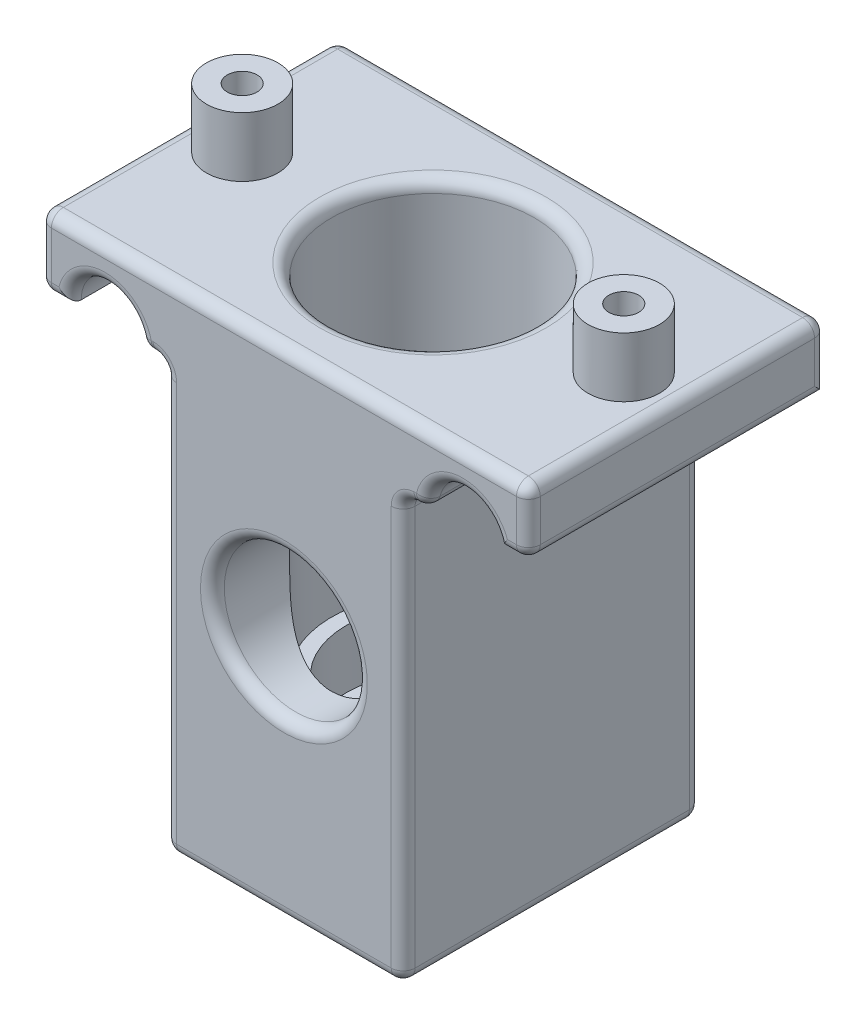
from build123d import *

# Parameters (mm, degrees)
CROQUIS1_R                                           = 6
SALIENTE_EXTRUIR1_DEPTH                              = 12.5
CROQUIS2_R                                           = 8.5
CORTAR_EXTRUIR1_DEPTH                                = 30
REDONDEO2_R                                          = 1
CROQUIS5_R                                           = 3
SALIENTE_EXTRUIR2_DEPTH                              = 5
PERFORADOR_PARA_ROSCAR_PARA_MACHO_DE_ROS_D           = 2.5
PERFORADOR_PARA_ROSCAR_PARA_MACHO_DE_ROS_DEPTH       = 5
PERFORADOR_PARA_ROSCAR_PARA_MACHO_DE_ROS_TIP         = 0.751075774
REFRENTADO_PARA_PERNO_CON_CABEZA_HEXAGON_D           = 6.6
REFRENTADO_PARA_PERNO_CON_CABEZA_HEXAGON_CBORE_D     = 14.55
REFRENTADO_PARA_PERNO_CON_CABEZA_HEXAGON_CBORE_DEPTH = 4.88


with BuildPart() as part:
    # Croquis1 → Saliente-Extruir1 (new, symmetric)
    with BuildSketch(Plane.XY):
        with BuildLine():
            Line((-18.001838681, 14.939365714), (-20.5, 14.939365714))
            Line((-20.5, 14.939365714), (-20.5, 20.90647064))
            Line((-20.5, 20.90647064), (20.5, 20.90647064))
            Line((20.5, 20.90647064), (20.5, 15.40647064))
            Line((20.5, 15.40647064), (17.972336054, 15.40647064))
            ThreePointArc((17.972336054, 15.40647064), (14.796294529, 17.993076023), (12, 15))
            Line((12, 15), (10, 14.909006744))
            Line((10, 14.909006744), (10, -20.590993256))
            Line((10, -20.590993256), (-10, -20.590993256))
            Line((-10, -20.590993256), (-10, 14.909006744))
            Line((-10, 14.909006744), (-12.001838681, 14.939365714))
            ThreePointArc((-12.001838681, 14.939365714), (-15.001838681, 17.939365714), (-18.001838681, 14.939365714))
        make_face()
        Circle(CROQUIS1_R, mode=Mode.SUBTRACT)
    extrude(amount=SALIENTE_EXTRUIR1_DEPTH, both=True)

    # Croquis2 → Cortar-Extruir1 (cut)
    with BuildSketch(Plane(origin=(0, 20.90647064, 0), x_dir=(1, 0, 0), z_dir=(0, 1, 0))):
        with Locations(Location((0, 0, 0), (0, 0, 270))):
            Circle(CROQUIS2_R)
    extrude(amount=-CORTAR_EXTRUIR1_DEPTH, mode=Mode.SUBTRACT)

    # Redondeo2
    redondeo2_edges = [part.edges().sort_by_distance(p)[0] for p in [
        (-19.250919341, 14.939365714, 12.5),
        (20.5, 18.15647064, -12.5),
        (11, 14.954503372, -12.5),
        (10, -2.840993256, -12.5),
        (0, -20.590993256, -12.5),
        (-15.001838681, 17.939365714, 12.5),
        (-10, -2.840993256, -12.5),
        (-11.000919341, 14.924186229, -12.5),
        (-20.5, 17.922918177, -12.5),
        (0, 20.90647064, -12.5),
        (-11.000919341, 14.924186229, 12.5),
        (-10, -2.840993256, 12.5),
        (20.5, 20.90647064, 0),
        (20.5, 15.40647064, 0),
        (12, 15, 0),
        (10, 14.909006744, 0),
        (10, -20.590993256, 0),
        (-10, -20.590993256, 0),
        (-10, 14.909006744, 0),
        (-12.001838681, 14.939365714, 0),
        (-20.5, 14.939365714, 0),
        (-20.5, 20.90647064, 0),
        (0, -20.590993256, 12.5),
        (10, -2.840993256, 12.5),
        (11, 14.954503372, 12.5),
        (-6, 0, -12.5),
        (-6, 0, 12.5),
        (14.796294529, 17.993076023, 12.5),
        (19.236168027, 15.40647064, 12.5),
        (20.5, 18.15647064, 12.5),
        (0, 20.90647064, 12.5),
        (0, 20.90647064, -8.5),
        (-20.5, 17.922918177, 12.5),
    ]]
    fillet(redondeo2_edges, radius=REDONDEO2_R)

    # Croquis5 → Saliente-Extruir2 (add)
    with BuildSketch(Plane(origin=(0, 20.90647064, 0), x_dir=(1, 0, 0), z_dir=(0, 1, 0))):
        with Locations(Location((-16, 0, 0), (0, 0, 90))):
            Circle(CROQUIS5_R)
        with Locations(Location((16, 0, 0), (0, 0, 90))):
            Circle(CROQUIS5_R)
    extrude(amount=SALIENTE_EXTRUIR2_DEPTH)

    # Perforador para roscar para macho de roscar para M3x0.51
    with Locations(Plane(origin=(0, 25.90647064, 0), x_dir=(1, 0, 0), z_dir=(0, 1, 0))):
        with Locations((-16, 0), (16, 0)):
            Hole(PERFORADOR_PARA_ROSCAR_PARA_MACHO_DE_ROS_D / 2, depth=PERFORADOR_PARA_ROSCAR_PARA_MACHO_DE_ROS_DEPTH)
            with Locations((0, 0, -(PERFORADOR_PARA_ROSCAR_PARA_MACHO_DE_ROS_DEPTH + PERFORADOR_PARA_ROSCAR_PARA_MACHO_DE_ROS_TIP / 2))):  # 118° drill point
                Cone(0, PERFORADOR_PARA_ROSCAR_PARA_MACHO_DE_ROS_D / 2, PERFORADOR_PARA_ROSCAR_PARA_MACHO_DE_ROS_TIP, mode=Mode.SUBTRACT)

    # Refrentado para perno con cabeza hexagonal de M61 (through all)
    with Locations(Plane(origin=(0, -9.09352936, 0), x_dir=(1, 0, 0), z_dir=(0, 1, 0))):
        with Locations((0, 0)):
            CounterBoreHole(REFRENTADO_PARA_PERNO_CON_CABEZA_HEXAGON_D / 2, REFRENTADO_PARA_PERNO_CON_CABEZA_HEXAGON_CBORE_D / 2, REFRENTADO_PARA_PERNO_CON_CABEZA_HEXAGON_CBORE_DEPTH)


solid = part.part
